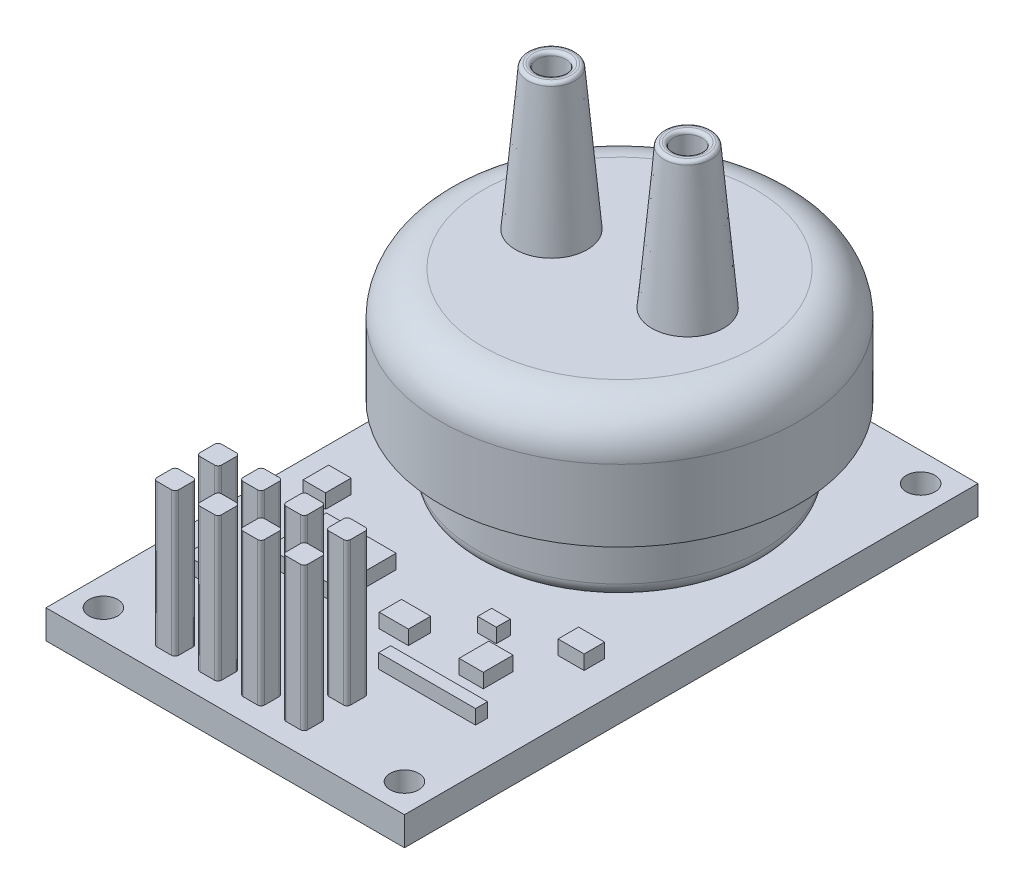
from build123d import *

# Parameters (mm, degrees)
SKETCH1_W                     = 25
SKETCH1_H                     = 40
SKETCH1_R                     = 1
BOSS_EXTRUDE1_DEPTH           = 2
SKETCH4_R                     = 2.5
BOSS_EXTRUDE2_DEPTH           = 10
BOSS_EXTRUDE2_DRAFT           = 5
BOSS_EXTRUDE2_PROFILE_2_DEPTH = 10
BOSS_EXTRUDE2_PROFILE_2_DRAFT = 5
SKETCH5_R                     = 1
CUT_EXTRUDE1_DEPTH            = 10
FILLET1_R                     = 0.25
SKETCH6_W                     = 4.872569901
SKETCH6_H                     = 4.155954741
SKETCH6_W_2                   = 1.691295461
SKETCH6_H_2                   = 2.07797737
SKETCH6_W_3                   = 2.035864878
SKETCH6_H_3                   = 1.553653313
SKETCH6_W_4                   = 1.303496039
SKETCH6_H_4                   = 0.977650804
SKETCH6_W_5                   = 1.818772584
SKETCH6_H_5                   = 1.432521154
SKETCH6_W_6                   = 1.566973501
SKETCH6_H_6                   = 1.785192301
SKETCH6_W_7                   = 1.179459655
SKETCH6_H_7                   = 1.672408866
SKETCH6_W_8                   = 6.757272552
SKETCH6_H_8                   = 0.836204433
BOSS_EXTRUDE3_DEPTH           = 1
BOSS_EXTRUDE4_DEPTH           = 10


with BuildPart() as part:
    # Sketch1 → Boss-Extrude1 (new body)
    with BuildSketch(Plane(origin=(0, 0, 0), x_dir=(1, 0, 0), z_dir=(0, 1, 0))):
        with Locations((0, -20)):
            Rectangle(SKETCH1_W, SKETCH1_H)
        with Locations(Location((-10.5, -2, 0), (0, 0, 270))):
            Circle(SKETCH1_R, mode=Mode.SUBTRACT)
        with Locations(Location((10.5, -2, 0), (0, 0, 90))):
            Circle(SKETCH1_R, mode=Mode.SUBTRACT)
        with Locations(Location((10.5, -38, 0), (0, 0, 270))):
            Circle(SKETCH1_R, mode=Mode.SUBTRACT)
        with Locations(Location((-10.5, -38, 0), (0, 0, 90))):
            Circle(SKETCH1_R, mode=Mode.SUBTRACT)
    extrude(amount=BOSS_EXTRUDE1_DEPTH)

    # Sketch3 → Revolve1 (revolve)
    with BuildSketch(Plane(origin=(0, 0, 0), x_dir=(0, 0, -1), z_dir=(1, 0, 0))):
        with BuildLine():
            Line((-12.5, 2), (-3.5, 2))
            ThreePointArc((-3.5, 2), (-2.792893219, 2.292893219), (-2.5, 3))
            Line((-2.5, 3), (-2.5, 6))
            ThreePointArc((-2.5, 6), (-2.207106781, 6.707106781), (-1.5, 7))
            Line((-1.5, 7), (0, 7))
            Line((0, 7), (0, 12))
            ThreePointArc((0, 12), (-0.878679656, 14.121320344), (-3, 15))
            Line((-3, 15), (-12.5, 15))
            Line((-12.5, 15), (-12.5, 2))
        make_face()
    revolve(axis=Axis((0, -8.567405093, 12.5), (0, 1, 0)))


with BuildPart() as boss_extrude2_tool:
    # Sketch4 → Boss-Extrude2 (with draft: the straight prism first)
    with BuildSketch(Plane(origin=(0, 15, 0), x_dir=(1, 0, 0), z_dir=(0, 1, 0))):
        with Locations((4.75, -12.5)):
            Circle(SKETCH4_R)
    extrude(amount=BOSS_EXTRUDE2_DEPTH)
    # Boss-Extrude2: the draft: its side faces are tilted about the plane it starts from
    boss_extrude2_sides = [boss_extrude2_tool.faces().sort_by_distance(p)[0] for p in [
        (2.25, 20, 12.5),
    ]]
    draft(boss_extrude2_sides, Plane(origin=(0, 15, 0), x_dir=(1, 0, 0), z_dir=(0, 1, 0)), BOSS_EXTRUDE2_DRAFT)


with BuildPart() as part_1:
    add(part.part)

    # Boss-Extrude2: add boss_extrude2_tool
    add(boss_extrude2_tool.part)


with BuildPart() as boss_extrude2_profile_2_tool:
    # Sketch4 → Boss-Extrude2 profile 2 (with draft: the straight prism first)
    with BuildSketch(Plane(origin=(0, 15, 0), x_dir=(1, 0, 0), z_dir=(0, 1, 0))):
        with Locations((-4.75, -12.5)):
            Circle(SKETCH4_R)
    extrude(amount=BOSS_EXTRUDE2_PROFILE_2_DEPTH)
    # Boss-Extrude2 profile 2: the draft: its side faces are tilted about the plane it starts from
    boss_extrude2_profile_2_sides = [boss_extrude2_profile_2_tool.faces().sort_by_distance(p)[0] for p in [
        (-7.25, 20, 12.5),
    ]]
    draft(boss_extrude2_profile_2_sides, Plane(origin=(0, 15, 0), x_dir=(1, 0, 0), z_dir=(0, 1, 0)), BOSS_EXTRUDE2_PROFILE_2_DRAFT)


with BuildPart() as part_2:
    add(part_1.part)

    # Boss-Extrude2 profile 2: add boss_extrude2_profile_2_tool
    add(boss_extrude2_profile_2_tool.part)

    # Sketch5 → Cut-Extrude1 (cut)
    with BuildSketch(Plane(origin=(0, 25, 0), x_dir=(1, 0, 0), z_dir=(0, 1, 0))):
        with Locations(Location((-4.75, -12.5, 0), (0, 0, 270))):
            Circle(SKETCH5_R)
        with Locations(Location((4.75, -12.5, 0), (0, 0, 270))):
            Circle(SKETCH5_R)
    extrude(amount=-CUT_EXTRUDE1_DEPTH, mode=Mode.SUBTRACT)

    # Fillet1
    fillet1_edges = [part_2.edges().sort_by_distance(p)[0] for p in [
        (3.124886635, 25, 12.5),
        (-6.375113365, 25, 12.5),
        (-4.75, 25, 11.5),
        (4.75, 25, 11.5),
    ]]
    fillet(fillet1_edges, radius=FILLET1_R)

    # Sketch6 → Boss-Extrude3 (add)
    with BuildSketch(Plane(origin=(0, 2, 0), x_dir=(1, 0, 0), z_dir=(0, 1, 0))):
        with Locations((-5.020317753, -27.572240941)):
            Rectangle(SKETCH6_W, SKETCH6_H)
        with Locations((6.803567201, -28.611229626)):
            Rectangle(SKETCH6_W_2, SKETCH6_H_2)
        with Locations((1.407218924, -28.873391655)):
            Rectangle(SKETCH6_W_3, SKETCH6_H_3)
        with Locations((4.723365873, -25.983088972)):
            Rectangle(SKETCH6_W_4, SKETCH6_H_4)
        with Locations((9.147060432, -24.311320158)):
            Rectangle(SKETCH6_W_5, SKETCH6_H_5)
        with Locations((-9.47826935, -23.418724008)):
            Rectangle(SKETCH6_W_6, SKETCH6_H_6)
        with Locations((-9.284512428, -32.111266319)):
            Rectangle(SKETCH6_W_7, SKETCH6_H_7)
        with Locations((6.19064479, -31.693164103)):
            Rectangle(SKETCH6_W_8, SKETCH6_H_8)
    extrude(amount=BOSS_EXTRUDE3_DEPTH)

    # Sketch7 → Boss-Extrude4 (add)
    with BuildSketch(Plane(origin=(0, 2, 0), x_dir=(1, 0, 0), z_dir=(0, 1, 0))):
        with BuildLine():
            Line((-6.25, -34), (-5.25, -34))
            ThreePointArc((-5.25, -34), (-5.073223305, -34.073223305), (-5, -34.25))
            Line((-5, -34.25), (-5, -35.25))
            ThreePointArc((-5, -35.25), (-5.073223305, -35.426776695), (-5.25, -35.5))
            Line((-5.25, -35.5), (-6.25, -35.5))
            ThreePointArc((-6.25, -35.5), (-6.426776695, -35.426776695), (-6.5, -35.25))
            Line((-6.5, -35.25), (-6.5, -34.25))
            ThreePointArc((-6.5, -34.25), (-6.426776695, -34.073223305), (-6.25, -34))
        make_face()
        with BuildLine():
            Line((-3.5, -34.25), (-3.5, -35.25))
            ThreePointArc((-3.5, -35.25), (-3.426776695, -35.426776695), (-3.25, -35.5))
            Line((-3.25, -35.5), (-2.25, -35.5))
            ThreePointArc((-2.25, -35.5), (-2.073223305, -35.426776695), (-2, -35.25))
            Line((-2, -35.25), (-2, -34.25))
            ThreePointArc((-2, -34.25), (-2.073223305, -34.073223305), (-2.25, -34))
            Line((-2.25, -34), (-3.25, -34))
            ThreePointArc((-3.25, -34), (-3.426776695, -34.073223305), (-3.5, -34.25))
        make_face()
        with BuildLine():
            Line((-0.5, -34.25), (-0.5, -35.25))
            ThreePointArc((-0.5, -35.25), (-0.426776695, -35.426776695), (-0.25, -35.5))
            Line((-0.25, -35.5), (0.75, -35.5))
            ThreePointArc((0.75, -35.5), (0.926776695, -35.426776695), (1, -35.25))
            Line((1, -35.25), (1, -34.25))
            ThreePointArc((1, -34.25), (0.926776695, -34.073223305), (0.75, -34))
            Line((0.75, -34), (-0.25, -34))
            ThreePointArc((-0.25, -34), (-0.426776695, -34.073223305), (-0.5, -34.25))
        make_face()
        with BuildLine():
            Line((2.5, -34.25), (2.5, -35.25))
            ThreePointArc((2.5, -35.25), (2.573223305, -35.426776695), (2.75, -35.5))
            Line((2.75, -35.5), (3.75, -35.5))
            ThreePointArc((3.75, -35.5), (3.926776695, -35.426776695), (4, -35.25))
            Line((4, -35.25), (4, -34.25))
            ThreePointArc((4, -34.25), (3.926776695, -34.073223305), (3.75, -34))
            Line((3.75, -34), (2.75, -34))
            ThreePointArc((2.75, -34), (2.573223305, -34.073223305), (2.5, -34.25))
        make_face()
        with BuildLine():
            Line((-3.5, -37.25), (-3.5, -38.25))
            ThreePointArc((-3.5, -38.25), (-3.426776695, -38.426776695), (-3.25, -38.5))
            Line((-3.25, -38.5), (-2.25, -38.5))
            ThreePointArc((-2.25, -38.5), (-2.073223305, -38.426776695), (-2, -38.25))
            Line((-2, -38.25), (-2, -37.25))
            ThreePointArc((-2, -37.25), (-2.073223305, -37.073223305), (-2.25, -37))
            Line((-2.25, -37), (-3.25, -37))
            ThreePointArc((-3.25, -37), (-3.426776695, -37.073223305), (-3.5, -37.25))
        make_face()
        with BuildLine():
            Line((-0.5, -37.25), (-0.5, -38.25))
            ThreePointArc((-0.5, -38.25), (-0.426776695, -38.426776695), (-0.25, -38.5))
            Line((-0.25, -38.5), (0.75, -38.5))
            ThreePointArc((0.75, -38.5), (0.926776695, -38.426776695), (1, -38.25))
            Line((1, -38.25), (1, -37.25))
            ThreePointArc((1, -37.25), (0.926776695, -37.073223305), (0.75, -37))
            Line((0.75, -37), (-0.25, -37))
            ThreePointArc((-0.25, -37), (-0.426776695, -37.073223305), (-0.5, -37.25))
        make_face()
        with BuildLine():
            Line((2.5, -37.25), (2.5, -38.25))
            ThreePointArc((2.5, -38.25), (2.573223305, -38.426776695), (2.75, -38.5))
            Line((2.75, -38.5), (3.75, -38.5))
            ThreePointArc((3.75, -38.5), (3.926776695, -38.426776695), (4, -38.25))
            Line((4, -38.25), (4, -37.25))
            ThreePointArc((4, -37.25), (3.926776695, -37.073223305), (3.75, -37))
            Line((3.75, -37), (2.75, -37))
            ThreePointArc((2.75, -37), (2.573223305, -37.073223305), (2.5, -37.25))
        make_face()
        with BuildLine():
            Line((-6.5, -37.25), (-6.5, -38.25))
            ThreePointArc((-6.5, -38.25), (-6.426776695, -38.426776695), (-6.25, -38.5))
            Line((-6.25, -38.5), (-5.25, -38.5))
            ThreePointArc((-5.25, -38.5), (-5.073223305, -38.426776695), (-5, -38.25))
            Line((-5, -38.25), (-5, -37.25))
            ThreePointArc((-5, -37.25), (-5.073223305, -37.073223305), (-5.25, -37))
            Line((-5.25, -37), (-6.25, -37))
            ThreePointArc((-6.25, -37), (-6.426776695, -37.073223305), (-6.5, -37.25))
        make_face()
    extrude(amount=BOSS_EXTRUDE4_DEPTH)


solid = part_2.part
